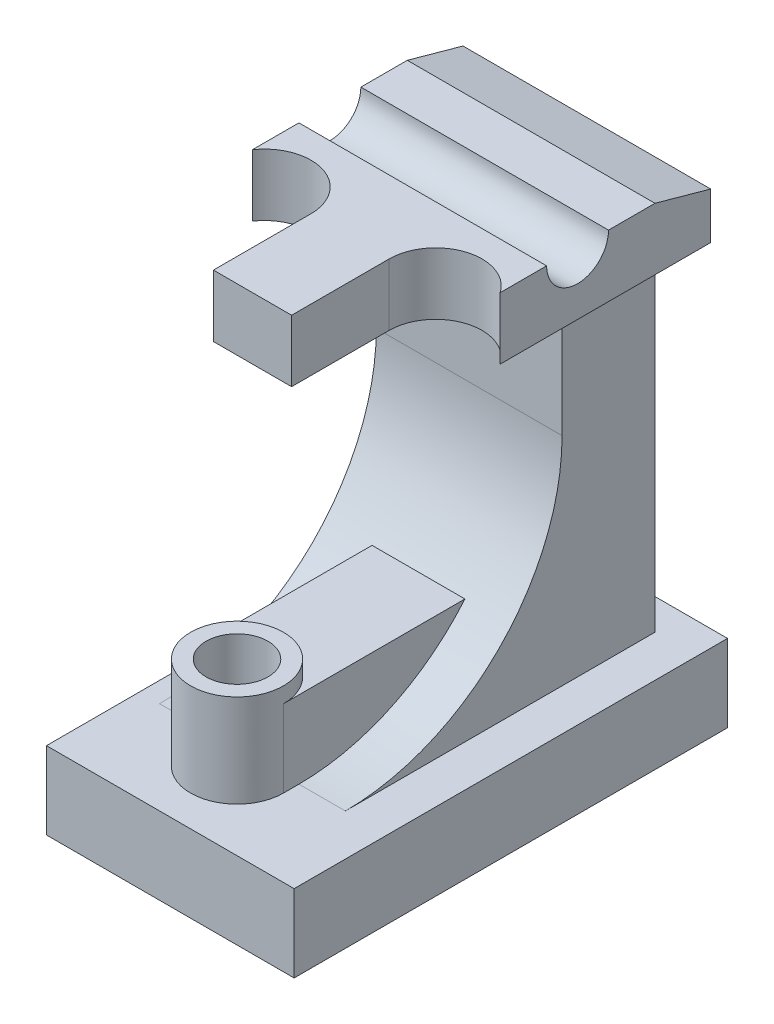
from build123d import *

# Parameters (mm, degrees)
SKETCH1_W                = 80
SKETCH1_H                = 140
BOSS_EXTRUDE1_DEPTH      = 25
BOSS_EXTRUDE2_DEPTH      = 30
BOSS_EXTRUDE2_DEPTH_BACK = 30
BOSS_EXTRUDE3_REACH      = 135.781
SKETCH3_R                = 15
SKETCH3_R_2              = 10
BOSS_EXTRUDE7_DEPTH      = 30
BOSS_EXTRUDE8_DEPTH      = 20
CUT_EXTRUDE1_REACH       = 202.087


with BuildPart() as part:
    # Sketch1 → Boss-Extrude1 (new body)
    with BuildSketch(Plane(origin=(0, 0, 0), x_dir=(1, 0, 0), z_dir=(0, 1, 0))):
        with Locations((3.446067736, -28.029835879)):
            Rectangle(SKETCH1_W, SKETCH1_H)
    extrude(amount=BOSS_EXTRUDE1_DEPTH)

    # Sketch2 → Boss-Extrude2 (add, two sides: drawn at the far end of the back side and taken through both)
    with BuildSketch(Plane(origin=(0, 0, 0), x_dir=(0, 0, -1), z_dir=(1, 0, 0)).offset(-BOSS_EXTRUDE2_DEPTH_BACK)):
        with BuildLine():
            Line((31.970164121, 25), (31.970164121, 135))
            Line((31.970164121, 135), (1.970164121, 135))
            Line((1.970164121, 135), (1.970164121, 95))
            ThreePointArc((1.970164121, 95), (-18.532361196, 45.502525317), (-68.029835879, 25))
            Line((-68.029835879, 25), (31.970164121, 25))
        make_face()
    extrude(amount=BOSS_EXTRUDE2_DEPTH + BOSS_EXTRUDE2_DEPTH_BACK)

    # Sketch3 → Boss-Extrude3 (add, up to next)
    with BuildSketch(Plane(origin=(0, 55, 0), x_dir=(1, 0, 0), z_dir=(0, 1, 0)), mode=Mode.PRIVATE) as boss_extrude3_sk1:
        with Locations(Location((0, -73.029835879, 0), (0, 0, 270))):
            Circle(SKETCH3_R)
        with Locations(Location((0, -73.029835879, 0), (0, 0, 270))):
            Circle(SKETCH3_R_2, mode=Mode.SUBTRACT)
    boss_extrude3_tool1 = extrude(boss_extrude3_sk1.sketch, amount=-BOSS_EXTRUDE3_REACH, mode=Mode.PRIVATE) - part.part
    add(boss_extrude3_tool1.solids().sort_by_distance((0, 55, 58.4541))[0])

    # Sketch4 → Boss-Extrude7 (add)
    with BuildSketch(Plane(origin=(0, 50, 0), x_dir=(1, 0, 0), z_dir=(0, 1, 0))):
        with BuildLine():
            ThreePointArc((-15, -73.029835859), (6e-09, -58.029835879), (15, -73.029835871))
            Line((15, -73.029835871), (15, -7.547322413))
            Line((15, -7.547322413), (-15, -7.547322413))
            Line((-15, -7.547322413), (-15, -73.029835859))
        make_face()
    extrude(amount=-BOSS_EXTRUDE7_DEPTH)

    # Sketch7 → Boss-Extrude8 (add)
    with BuildSketch(Plane(origin=(0, 135, 0), x_dir=(1, 0, 0), z_dir=(0, 1, 0))):
        with BuildLine():
            Line((12.629019998, -36.512692343), (12.629019998, -68.029835879))
            Line((12.629019998, -68.029835879), (-12.629019998, -68.029835879))
            Line((-12.629019998, -68.029835879), (-12.629019998, -36.512692343))
            ThreePointArc((-12.629019998, -36.512692343), (-23.188563942, -22.185014582), (-40, -28.029835879))
            Line((-40, -28.029835879), (-40, 39.970164121))
            Line((-40, 39.970164121), (40, 39.970164121))
            Line((40, 39.970164121), (40, -28.029835879))
            ThreePointArc((40, -28.029835879), (23.188563942, -22.185014582), (12.629019998, -36.512692343))
        make_face()
    extrude(amount=BOSS_EXTRUDE8_DEPTH)

    # Sketch8 → Cut-Extrude1 (cut, up to next)
    with BuildSketch(Plane(origin=(40, 0, 0), x_dir=(0, 0, -1), z_dir=(1, 0, 0)), mode=Mode.PRIVATE) as cut_extrude1_sk1:
        Polygon((21.970164121, 155), (39.970164121, 155), (39.970164121, 150), align=None)
    cut_extrude1_tool1 = extrude(cut_extrude1_sk1.sketch, amount=-CUT_EXTRUDE1_REACH, mode=Mode.PRIVATE) & part.part
    # Sketch8 → Cut-Extrude1 (cut, up to next)
    with BuildSketch(Plane(origin=(40, 0, 0), x_dir=(0, 0, -1), z_dir=(1, 0, 0)), mode=Mode.PRIVATE) as cut_extrude1_sk2:
        with BuildLine():
            Line((-13.029835879, 155), (6.970164121, 155))
            ThreePointArc((6.970164121, 155), (-3.029835879, 145), (-13.029835879, 155))
        make_face()
    cut_extrude1_tool2 = extrude(cut_extrude1_sk2.sketch, amount=-CUT_EXTRUDE1_REACH, mode=Mode.PRIVATE) & part.part
    add(cut_extrude1_tool1.solids().sort_by_distance((40, 153.333333, -33.970164))[0], mode=Mode.SUBTRACT)
    add(cut_extrude1_tool2.solids().sort_by_distance((40, 150.755868, 3.029836))[0], mode=Mode.SUBTRACT)


solid = part.part
